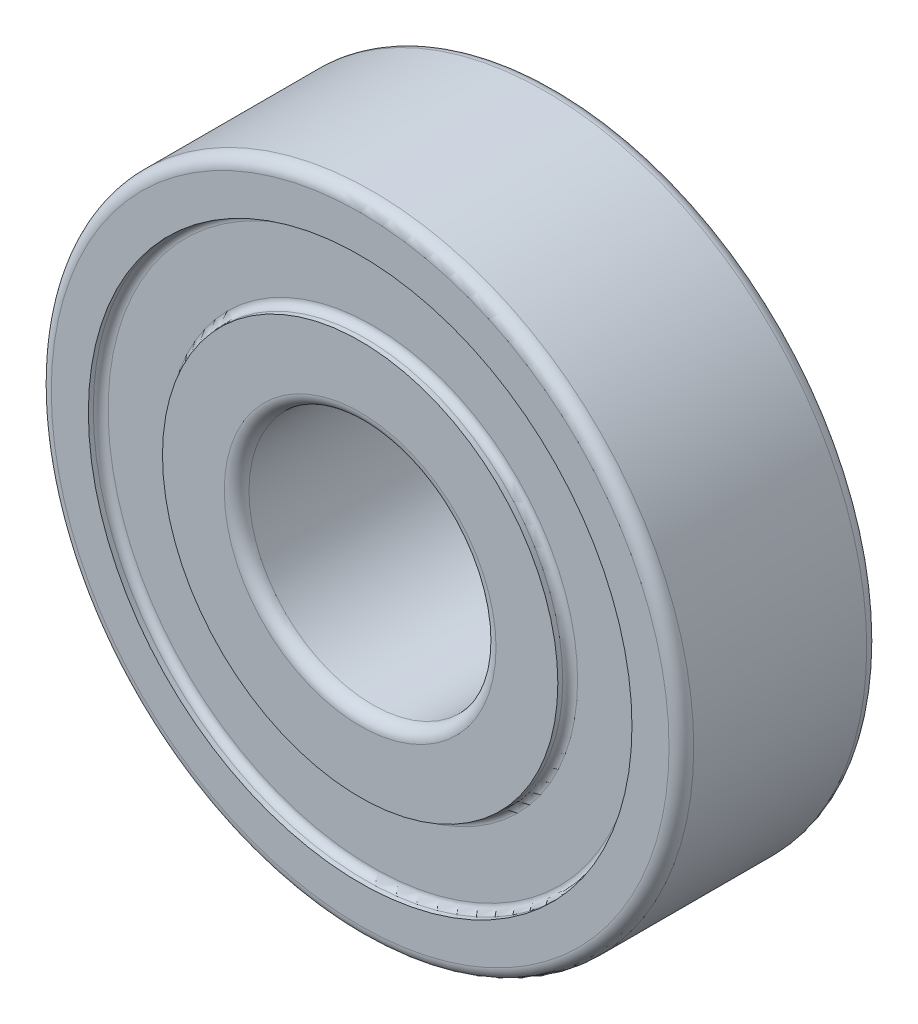
from build123d import *

# Parameters (mm, degrees)
SKIZZE1_R                       = 13
SKIZZE1_R_2                     = 5
AUFSATZ_LINEAR_AUSTRAGEN1_DEPTH = 8
VERRUNDUNG1_R                   = 0.5
SKIZZE2_R                       = 11
SKIZZE2_R_2                     = 8
SCHNITT_LINEAR_AUSTRAGEN1_DEPTH = 0.5
SCHNITT_LINEAR_START            = -0.5
SKIZZE3_R                       = 11
SKIZZE3_R_2                     = 8
SCHNITT_LINEAR_AUSTRAGEN2_DEPTH = 0.5
VERRUNDUNG2_R                   = 0.3


with BuildPart() as part:
    # Skizze1 → Aufsatz-Linear austragen1 (new body)
    with BuildSketch(Plane.XY):
        Circle(SKIZZE1_R)
        Circle(SKIZZE1_R_2, mode=Mode.SUBTRACT)
    extrude(amount=AUFSATZ_LINEAR_AUSTRAGEN1_DEPTH)

    # Verrundung1
    verrundung1_edges = [part.edges().sort_by_distance(p)[0] for p in [
        (-13, 0, 0),
        (-13, 0, 8),
        (-5, 0, 0),
        (-5, 0, 8),
    ]]
    fillet(verrundung1_edges, radius=VERRUNDUNG1_R)

    # Skizze2 → Schnitt-Linear austragen1 (cut)
    with BuildSketch(Plane(origin=(0, 0, 0), x_dir=(-1, 0, 0), z_dir=(0, 0, -1))):
        Circle(SKIZZE2_R)
        Circle(SKIZZE2_R_2, mode=Mode.SUBTRACT)
    extrude(amount=-SCHNITT_LINEAR_AUSTRAGEN1_DEPTH, mode=Mode.SUBTRACT)

    # Skizze3 → Schnitt-Linear austragen2 (cut)
    with BuildSketch(Plane.XY.offset(8).offset(SCHNITT_LINEAR_START)):
        with Locations(Location((0, 0, 0), (0, 0, 180))):
            Circle(SKIZZE3_R)
        with Locations(Location((0, 0, 0), (0, 0, 180))):
            Circle(SKIZZE3_R_2, mode=Mode.SUBTRACT)
    extrude(amount=SCHNITT_LINEAR_AUSTRAGEN2_DEPTH, mode=Mode.SUBTRACT)

    # Verrundung2
    verrundung2_edges = [part.edges().sort_by_distance(p)[0] for p in [
        (11, 0, 0.5),
        (8, 0, 0.5),
        (11, 0, 7.5),
        (8, 0, 7.5),
    ]]
    fillet(verrundung2_edges, radius=VERRUNDUNG2_R)


solid = part.part
